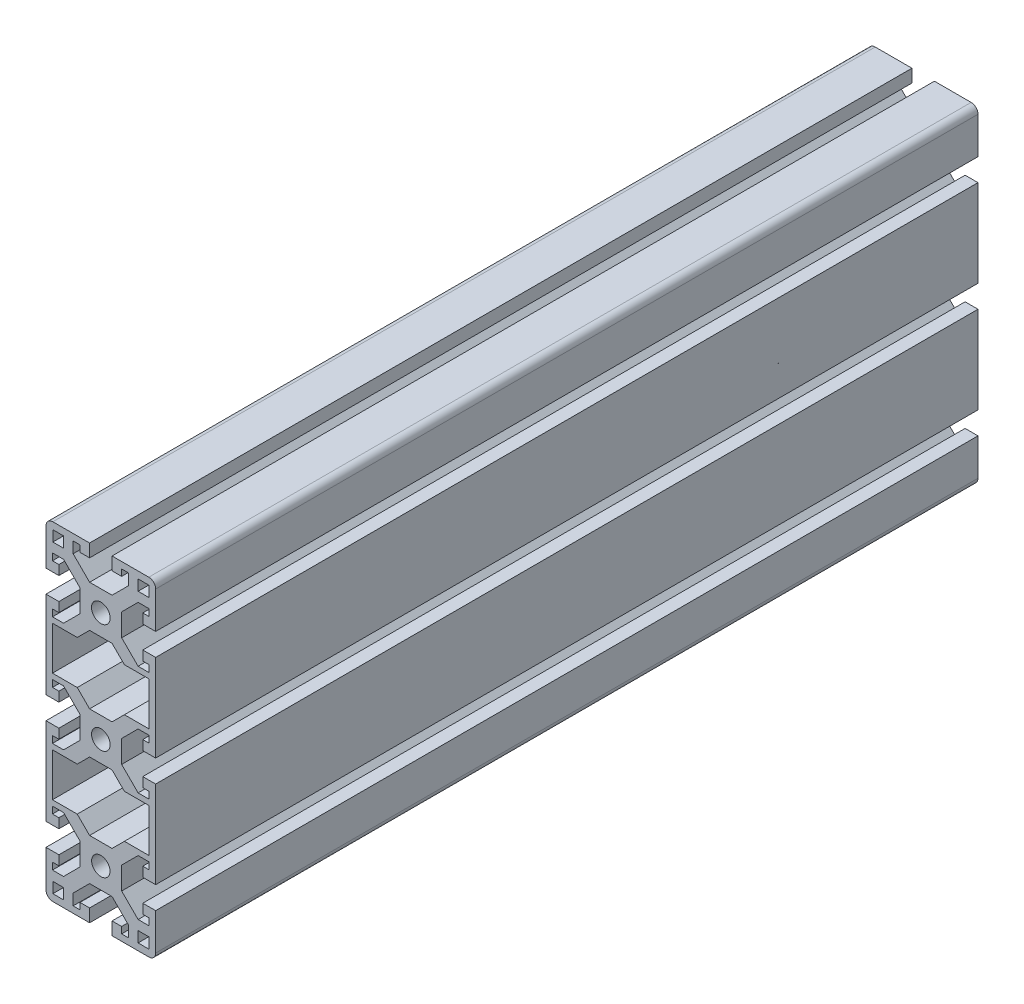
from build123d import *

# Parameters (mm, degrees)
SKETCH22_W                      = 3.9
SKETCH22_H                      = 3.9
F_40_SERIES_TS40_120LM_1_DEPTH  = 300
M8X1_25_TAPPED_HOLE1_AT_2_COUNT = 2
M8X1_25_TAPPED_HOLE1_AT_2_PITCH = 40


with BuildPart() as part:
    # Sketch22 → 40 series TS40-120LM(1) (new body)
    with BuildSketch(Plane(origin=(0, 0, 150), x_dir=(-1, 0, 0), z_dir=(0, 0, -1))):
        with BuildLine():
            Line((15.3, -35.9), (20, -35.9))
            Line((20, -35.9), (20, -4.1))
            Line((20, -4.1), (15.3, -4.1))
            Line((15.3, -4.1), (15.3, -7.6))
            Line((15.3, -7.6), (17.65, -7.6))
            Line((17.65, -7.6), (17.65, -10.1))
            Line((17.65, -10.1), (13.6, -10.1))
            Line((13.6, -10.1), (7.6, -4.1))
            Line((7.6, -4.1), (7.6, 4.1))
            Line((7.6, 4.1), (13.6, 10.1))
            Line((13.6, 10.1), (17.65, 10.1))
            Line((17.65, 10.1), (17.65, 7.6))
            Line((17.65, 7.6), (15.3, 7.6))
            Line((15.3, 7.6), (15.3, 4.1))
            Line((15.3, 4.1), (20, 4.1))
            Line((20, 4.1), (20, 35.9))
            Line((20, 35.9), (15.3, 35.9))
            Line((15.3, 35.9), (15.3, 32.4))
            Line((15.3, 32.4), (17.65, 32.4))
            Line((17.65, 32.4), (17.65, 29.9))
            Line((17.65, 29.9), (13.6, 29.9))
            Line((13.6, 29.9), (7.6, 35.9))
            Line((7.6, 35.9), (7.6, 44.1))
            Line((7.6, 44.1), (13.6, 50.1))
            Line((13.6, 50.1), (17.65, 50.1))
            Line((17.65, 50.1), (17.65, 47.6))
            Line((17.65, 47.6), (15.3, 47.6))
            Line((15.3, 47.6), (15.3, 44.1))
            Line((15.3, 44.1), (20, 44.1))
            Line((20, 44.1), (20, 57.5))
            ThreePointArc((20, 57.5), (19.267766953, 59.267766953), (17.5, 60))
            Line((17.5, 60), (4.1, 60))
            Line((4.1, 60), (4.1, 55.3))
            Line((4.1, 55.3), (7.6, 55.3))
            Line((7.6, 55.3), (7.6, 57.65))
            Line((7.6, 57.65), (10.1, 57.65))
            Line((10.1, 57.65), (10.1, 53.6))
            Line((10.1, 53.6), (4.1, 47.6))
            Line((4.1, 47.6), (-4.1, 47.6))
            Line((-4.1, 47.6), (-10.1, 53.6))
            Line((-10.1, 53.6), (-10.1, 57.65))
            Line((-10.1, 57.65), (-7.6, 57.65))
            Line((-7.6, 57.65), (-7.6, 55.3))
            Line((-7.6, 55.3), (-4.1, 55.3))
            Line((-4.1, 55.3), (-4.1, 60))
            Line((-4.1, 60), (-17.5, 60))
            ThreePointArc((-17.5, 60), (-19.267766953, 59.267766953), (-20, 57.5))
            Line((-20, 57.5), (-20, 44.1))
            Line((-20, 44.1), (-15.3, 44.1))
            Line((-15.3, 44.1), (-15.3, 47.6))
            Line((-15.3, 47.6), (-17.65, 47.6))
            Line((-17.65, 47.6), (-17.65, 50.1))
            Line((-17.65, 50.1), (-13.6, 50.1))
            Line((-13.6, 50.1), (-7.6, 44.1))
            Line((-7.6, 44.1), (-7.6, 35.9))
            Line((-7.6, 35.9), (-13.6, 29.9))
            Line((-13.6, 29.9), (-17.65, 29.9))
            Line((-17.65, 29.9), (-17.65, 32.4))
            Line((-17.65, 32.4), (-15.3, 32.4))
            Line((-15.3, 32.4), (-15.3, 35.9))
            Line((-15.3, 35.9), (-20, 35.9))
            Line((-20, 35.9), (-20, 4.1))
            Line((-20, 4.1), (-15.3, 4.1))
            Line((-15.3, 4.1), (-15.3, 7.6))
            Line((-15.3, 7.6), (-17.65, 7.6))
            Line((-17.65, 7.6), (-17.65, 10.1))
            Line((-17.65, 10.1), (-13.6, 10.1))
            Line((-13.6, 10.1), (-7.6, 4.1))
            Line((-7.6, 4.1), (-7.6, -4.1))
            Line((-7.6, -4.1), (-13.6, -10.1))
            Line((-13.6, -10.1), (-17.65, -10.1))
            Line((-17.65, -10.1), (-17.65, -7.6))
            Line((-17.65, -7.6), (-15.3, -7.6))
            Line((-15.3, -7.6), (-15.3, -4.1))
            Line((-15.3, -4.1), (-20, -4.1))
            Line((-20, -4.1), (-20, -35.9))
            Line((-20, -35.9), (-15.3, -35.9))
            Line((-15.3, -35.9), (-15.3, -32.4))
            Line((-15.3, -32.4), (-17.65, -32.4))
            Line((-17.65, -32.4), (-17.65, -29.9))
            Line((-17.65, -29.9), (-13.6, -29.9))
            Line((-13.6, -29.9), (-7.6, -35.9))
            Line((-7.6, -35.9), (-7.6, -44.1))
            Line((-7.6, -44.1), (-13.6, -50.1))
            Line((-13.6, -50.1), (-17.65, -50.1))
            Line((-17.65, -50.1), (-17.65, -47.6))
            Line((-17.65, -47.6), (-15.3, -47.6))
            Line((-15.3, -47.6), (-15.3, -44.1))
            Line((-15.3, -44.1), (-20, -44.1))
            Line((-20, -44.1), (-20, -57.5))
            ThreePointArc((-20, -57.5), (-19.267766953, -59.267766953), (-17.5, -60))
            Line((-17.5, -60), (-4.1, -60))
            Line((-4.1, -60), (-4.1, -55.3))
            Line((-4.1, -55.3), (-7.6, -55.3))
            Line((-7.6, -55.3), (-7.6, -57.65))
            Line((-7.6, -57.65), (-10.1, -57.65))
            Line((-10.1, -57.65), (-10.1, -53.6))
            Line((-10.1, -53.6), (-4.1, -47.6))
            Line((-4.1, -47.6), (4.1, -47.6))
            Line((4.1, -47.6), (10.1, -53.6))
            Line((10.1, -53.6), (10.1, -57.65))
            Line((10.1, -57.65), (7.6, -57.65))
            Line((7.6, -57.65), (7.6, -55.3))
            Line((7.6, -55.3), (4.1, -55.3))
            Line((4.1, -55.3), (4.1, -60))
            Line((4.1, -60), (17.5, -60))
            ThreePointArc((17.5, -60), (19.267766953, -59.267766953), (20, -57.5))
            Line((20, -57.5), (20, -44.1))
            Line((20, -44.1), (15.3, -44.1))
            Line((15.3, -44.1), (15.3, -47.6))
            Line((15.3, -47.6), (17.65, -47.6))
            Line((17.65, -47.6), (17.65, -50.1))
            Line((17.65, -50.1), (13.6, -50.1))
            Line((13.6, -50.1), (7.6, -44.1))
            Line((7.6, -44.1), (7.6, -35.9))
            Line((7.6, -35.9), (13.6, -29.9))
            Line((13.6, -29.9), (17.65, -29.9))
            Line((17.65, -29.9), (17.65, -32.4))
            Line((17.65, -32.4), (15.3, -32.4))
            Line((15.3, -32.4), (15.3, -35.9))
        make_face()
        Polygon((-4.1, -7.6), (4.1, -7.6), (8.6, -12.1), (17.65, -12.1), (17.65, -27.9), (8.6, -27.9), (4.1, -32.4), (-4.1, -32.4), (-8.6, -27.9), (-17.65, -27.9), (-17.65, -12.1), (-8.6, -12.1), align=None, mode=Mode.SUBTRACT)
        Polygon((-4.1, 7.6), (-8.6, 12.1), (-17.65, 12.1), (-17.65, 27.9), (-8.6, 27.9), (-4.1, 32.4), (4.1, 32.4), (8.6, 27.9), (17.65, 27.9), (17.65, 12.1), (8.6, 12.1), (4.1, 7.6), align=None, mode=Mode.SUBTRACT)
        with Locations((15.55, -55.55)):
            Rectangle(SKETCH22_W, SKETCH22_H, mode=Mode.SUBTRACT)
        with Locations((-15.55, -55.55)):
            Rectangle(SKETCH22_W, SKETCH22_H, mode=Mode.SUBTRACT)
        with Locations((-15.55, 55.55)):
            Rectangle(SKETCH22_W, SKETCH22_H, mode=Mode.SUBTRACT)
        with Locations((15.55, 55.55)):
            Rectangle(SKETCH22_W, SKETCH22_H, mode=Mode.SUBTRACT)
        with BuildLine():
            ThreePointArc((0, -43.35), (3.35, -40), (0, -36.65))
            ThreePointArc((0, -36.65), (-3.35, -40), (0, -43.35))
        make_face(mode=Mode.SUBTRACT)
        with BuildLine():
            ThreePointArc((3.35, 0), (0, -3.35), (-3.35, 0))
            ThreePointArc((-3.35, 0), (0, 3.35), (3.35, 0))
        make_face(mode=Mode.SUBTRACT)
        with BuildLine():
            ThreePointArc((0, 43.35), (-3.35, 40), (0, 36.65))
            ThreePointArc((0, 36.65), (3.35, 40), (0, 43.35))
        make_face(mode=Mode.SUBTRACT)
    extrude(amount=F_40_SERIES_TS40_120LM_1_DEPTH)

    # Sketch4 → M8x1.25 Tapped Hole1 (revolve, cut)
    with BuildSketch(Plane(origin=(0, 0, 150), x_dir=(0, -1, 0), z_dir=(1, 0, 0))):
        Polygon((0, 0), (0, 32.042926105), (3.4, 30), (3.4, 0), align=None)
    m8x1_25_tapped_hole1 = revolve(axis=Axis((0, 0, 156.35), (0, 0, -1)), mode=Mode.SUBTRACT)

    # M8x1.25 Tapped Hole1 at 2: M8x1.25 Tapped Hole1 ×2
    with Locations(*[(0, i * M8X1_25_TAPPED_HOLE1_AT_2_PITCH, 0) for i in range(1, M8X1_25_TAPPED_HOLE1_AT_2_COUNT)]):
        add(m8x1_25_tapped_hole1, mode=Mode.SUBTRACT)

    # Mirror1: M8x1.25 Tapped Hole1 across plane
    add(m8x1_25_tapped_hole1.mirror(Plane.XY), mode=Mode.SUBTRACT)

    # Mirror1 copy 1 sketch → Mirror1 copy 1 (revolve, cut)
    with BuildSketch(Plane(origin=(0, 40, -150), x_dir=(0, -1, 0), z_dir=(1, 0, 0))):
        Polygon((0, 0), (0, -32.042926105), (3.4, -30), (3.4, 0), align=None)
    revolve(axis=Axis((0, 40, -156.35), (0, 0, -1)), mode=Mode.SUBTRACT)


solid = part.part
